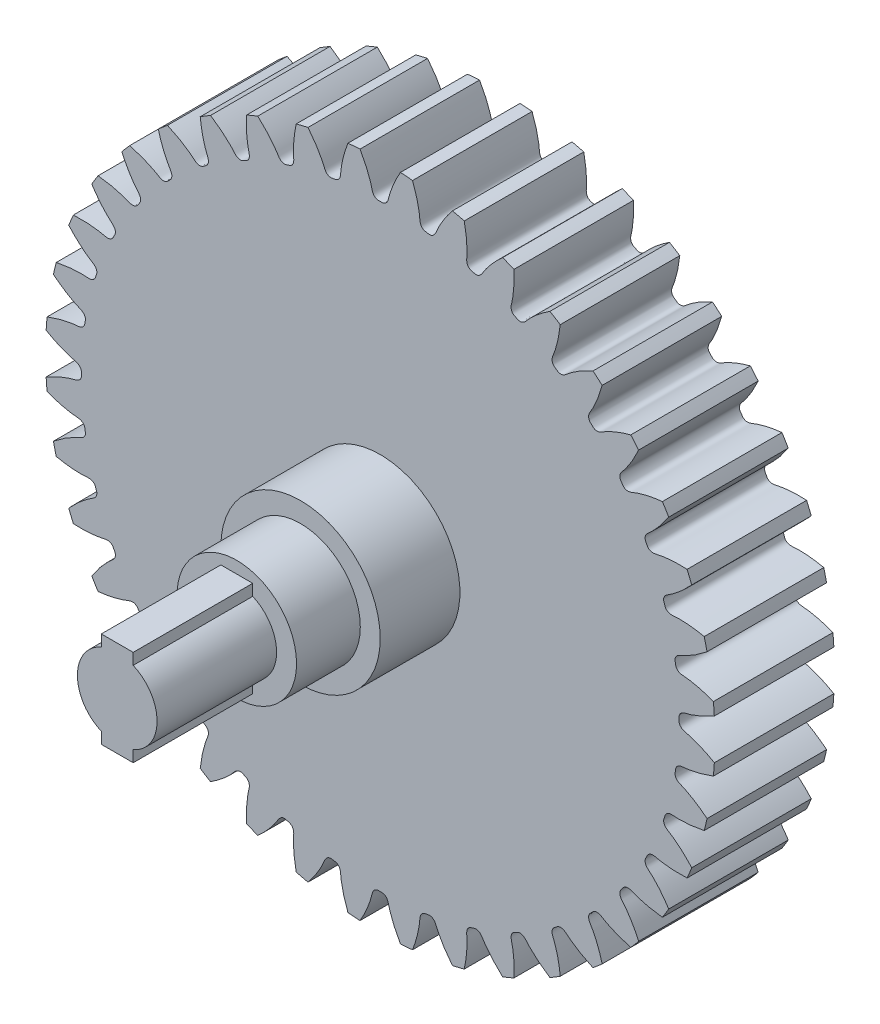
from build123d import *

# Parameters (mm, degrees)
SKETCH_314_W               = 15
SKETCH_314_H               = 41.999999369
CUT_EXTRUDE_511_DEPTH      = 7.5
PATTERN_CIRCULAR_561_COUNT = 40
SKETCH5_R                  = 10
EXTRUDE2_DEPTH             = 10
SKETCH6_R                  = 7.5
EXTRUDE3_DEPTH             = 8
SKETCH7_R                  = 5
EXTRUDE4_DEPTH             = 15
SKETCH9_W                  = 4
SKETCH9_H                  = 12
EXTRUDE5_DEPTH             = 15


with BuildPart() as part:
    # Sketch 314 → Revolve 377 (revolve)
    with BuildSketch(Plane(origin=(0, 0, 0), x_dir=(0, 0, -1), z_dir=(1, 0, 0)), mode=Mode.PRIVATE) as revolve_377_sk:
        with Locations((0, 20.999999685)):
            Rectangle(SKETCH_314_W, SKETCH_314_H)
    revolve(revolve_377_sk.sketch.rotate(Axis((0, 0, 0), (0, 0, -1)), 90), axis=Axis((0, 0, 0), (0, 0, -1)))

    # Sketch 418 → Cut-Extrude 511 (cut, symmetric)
    with BuildSketch(Plane.XY):
        with BuildLine():
            ThreePointArc((42.020093567, 2.59262095), (42.099999368, 0), (42.020093567, -2.59262095))
            add(Edge.make_bspline(
                [(42.020093567, -2.59262095), (41.744968284, -2.431865837), (41.379676231, -2.230509049), (40.923057504, -2.000315758), (40.667986259, -1.877350995), (40.421519303, -1.763874718), (40.183909703, -1.659541676), (39.955400856, -1.564000326), (39.736226413, -1.476893733), (39.526610417, -1.397858687), (39.326766176, -1.326529486), (39.13689963, -1.262526069), (38.95719733, -1.205495662), (38.78786689, -1.154972092), (38.628999657, -1.110852879), (38.43445521, -1.059503198), (38.274695974, -1.026195678), (38.151965766, -0.988057047), (38.104888022, -0.971862541), (38.058422932, -0.954152287), (38.012387339, -0.934693128), (37.966575561, -0.913170998), (37.920767202, -0.889173337), (37.874739808, -0.862157359), (37.82829618, -0.83141438), (37.78131483, -0.796030902), (37.733837268, -0.754857522), (37.686207747, -0.706509394), (37.639271953, -0.649443409), (37.594617117, -0.582183145), (37.554733479, -0.5037527), (37.523013953, -0.414339203), (37.503801386, -0.320156896), (37.495976972, -0.180861807), (37.502864172, 0), (37.495976972, 0.180861807), (37.503801386, 0.320156896), (37.523013953, 0.414339203), (37.554733479, 0.5037527), (37.594617117, 0.582183145), (37.639271953, 0.649443409), (37.686207747, 0.706509394), (37.733837268, 0.754857522), (37.78131483, 0.796030902), (37.82829618, 0.83141438), (37.874739808, 0.862157359), (37.920767202, 0.889173337), (37.966575561, 0.913170998), (38.012387339, 0.934693128), (38.058422932, 0.954152287), (38.104888022, 0.971862541), (38.151965766, 0.988057047), (38.274695974, 1.026195678), (38.43445521, 1.059503198), (38.628999657, 1.110852879), (38.78786689, 1.154972092), (38.95719733, 1.205495662), (39.13689963, 1.262526069), (39.326766176, 1.326529486), (39.526610417, 1.397858687), (39.736226413, 1.476893733), (39.955400856, 1.564000326), (40.183909703, 1.659541676), (40.421519303, 1.763874718), (40.667986259, 1.877350995), (40.923057504, 2.000315758), (41.379676231, 2.230509049), (41.744968284, 2.431865837), (42.020093567, 2.59262095)],
                knots=[0, 0, 0, 0, 0.086797207, 0.113582329, 0.139293424, 0.163930493, 0.187493535, 0.209982551, 0.23139754, 0.251738502, 0.271005438, 0.289198348, 0.306317231, 0.322362087, 0.337332917, 0.35122972, 0.377175602, 0.381718669, 0.386230975, 0.390735949, 0.395261843, 0.399842833, 0.404520321, 0.409344392, 0.414375302, 0.419684621, 0.425355328, 0.431479489, 0.438151326, 0.445452803, 0.45342956, 0.46205924, 0.471223133, 0.479505577, 0.5, 0.520494423, 0.528776867, 0.53794076, 0.54657044, 0.554547197, 0.561848674, 0.568520511, 0.574644672, 0.580315379, 0.585624698, 0.590655608, 0.595479679, 0.600157167, 0.604738157, 0.609264051, 0.613769025, 0.618281331, 0.622824398, 0.64877028, 0.662667083, 0.677637913, 0.693682769, 0.710801652, 0.728994562, 0.748261498, 0.76860246, 0.790017449, 0.812506465, 0.836069507, 0.860706576, 0.886417671, 0.913202793, 1, 1, 1, 1], degree=3))
        make_face()
    cut_extrude_511 = extrude(amount=CUT_EXTRUDE_511_DEPTH, both=True, mode=Mode.SUBTRACT)

    # Pattern Circular 561: Cut-Extrude 511 ×40 about axis
    pattern_circular_561_axis = Axis((0, 0, 55), (0, 0, -1))
    for i in range(1, PATTERN_CIRCULAR_561_COUNT):
        add(cut_extrude_511.rotate(pattern_circular_561_axis, i * 360 / PATTERN_CIRCULAR_561_COUNT), mode=Mode.SUBTRACT)

    # Sketch5 → Extrude2 (add)
    with BuildSketch(Plane.XY.offset(7.5)):
        with Locations(Location((0, 0, 0), (0, 0, 180))):
            Circle(SKETCH5_R)
    extrude(amount=EXTRUDE2_DEPTH)

    # Sketch6 → Extrude3 (add)
    with BuildSketch(Plane.XY.offset(17.5)):
        Circle(SKETCH6_R)
    extrude(amount=EXTRUDE3_DEPTH)

    # Sketch7 → Extrude4 (add)
    with BuildSketch(Plane.XY.offset(25.5)):
        Circle(SKETCH7_R)
    extrude(amount=EXTRUDE4_DEPTH)

    # Sketch9 → Extrude5 (add)
    with BuildSketch(Plane.XY.offset(40.5)):
        Rectangle(SKETCH9_W, SKETCH9_H)
    extrude(amount=-EXTRUDE5_DEPTH)


solid = part.part
